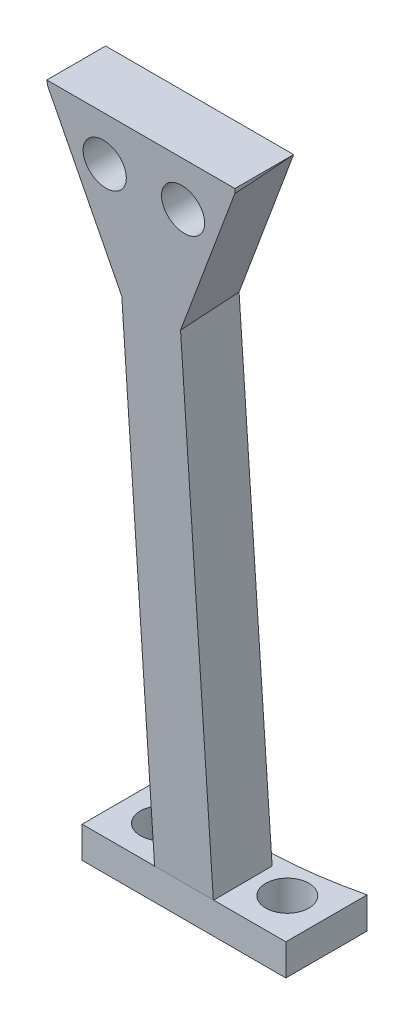
from build123d import *

# Parameters (mm, degrees)
BOSS_EXTRUDE1_DEPTH     = 2
SKETCH2_R               = 1.375
CUT_EXTRUDE1_DEPTH      = 2
CUT_EXTRUDE5_DEPTH      = 10
CUT_EXTRUDE3_DEPTH      = 46.516465277
CUT_EXTRUDE3_DEPTH_BACK = 46.516465277
SKETCH12_R              = 1.375


with BuildPart() as part:
    # Sketch1 → Boss-Extrude1 (new body)
    with BuildSketch(Plane(origin=(0, 0, 0), x_dir=(1, 0, 0), z_dir=(0, 1, 0))):
        with BuildLine():
            Line((-6.5, 0), (6.5, 0))
            Line((6.5, 0), (6.5, 5.19))
            add(Edge.make_bspline(
                [(-6.5, 5.19), (0, 3.63), (6.5, 5.19)],
                knots=[0, 0, 0, 1, 1, 1], degree=2))
            Line((-6.5, 5.19), (-6.5, 0))
        make_face()
    extrude(amount=BOSS_EXTRUDE1_DEPTH)

    # Sketch2 → Cut-Extrude1 (cut)
    with BuildSketch(Plane(origin=(0, 2, 0), x_dir=(1, 0, 0), z_dir=(0, 1, 0))):
        with Locations(Location((-4, 2.595, 0), (0, 0, 270))):
            Circle(SKETCH2_R)
        with Locations(Location((4, 2.595, 0), (0, 0, 270))):
            Circle(SKETCH2_R)
    extrude(amount=-CUT_EXTRUDE1_DEPTH, mode=Mode.SUBTRACT)

    # Sketch4 → Loft2 section 0
    with BuildSketch(Plane(origin=(0, 2, 0), x_dir=(1, 0, 0), z_dir=(0, 1, 0))):
        with BuildLine():
            Line((-1.875, 3.75), (1.875, 3.75))
            Line((1.875, 3.75), (1.875, 0))
            Line((1.875, 0), (-1.875, 0))
            Line((-1.875, 0), (-1.875, 3.75))
        make_face()
    # Sketch6 → Loft2 section 1
    with BuildSketch(Plane(origin=(0, 44.75, 0), x_dir=(1, 0, 0), z_dir=(0, 1, 0))):
        with BuildLine():
            Line((-6, 1), (6, 1))
            Line((6, 1), (6, -2.75))
            Line((6, -2.75), (-6, -2.75))
            Line((-6, -2.75), (-6, 1))
        make_face()
    loft()

    # Sketch16 → Cut-Extrude5 (cut)
    with BuildSketch(Plane(origin=(0, 0.248475921, -3.86267114), x_dir=(-1, 0, 0), z_dir=(0, 0.06419480263840949, -0.9979373864698206))):
        Polygon((-1.875, 1.755144263), (-1.875, 34.593503242), (-6, 44.593503242), align=None)
        Polygon((1.875, 34.593503242), (1.875, 1.755144263), (6, 44.593503242), align=None)
    extrude(amount=-CUT_EXTRUDE5_DEPTH, mode=Mode.SUBTRACT)

    # Sketch12 → Cut-Extrude3 (cut, two sides: drawn at the far end of the back side and taken through both)
    with BuildSketch(Plane.XY.offset(-CUT_EXTRUDE3_DEPTH_BACK)):
        with Locations(Location((-2.5, 41.75, 0), (0, 0, 90))):
            Circle(SKETCH12_R)
        with Locations(Location((2.5, 41.75, 0), (0, 0, 90))):
            Circle(SKETCH12_R)
    extrude(amount=CUT_EXTRUDE3_DEPTH + CUT_EXTRUDE3_DEPTH_BACK, mode=Mode.SUBTRACT)


solid = part.part
